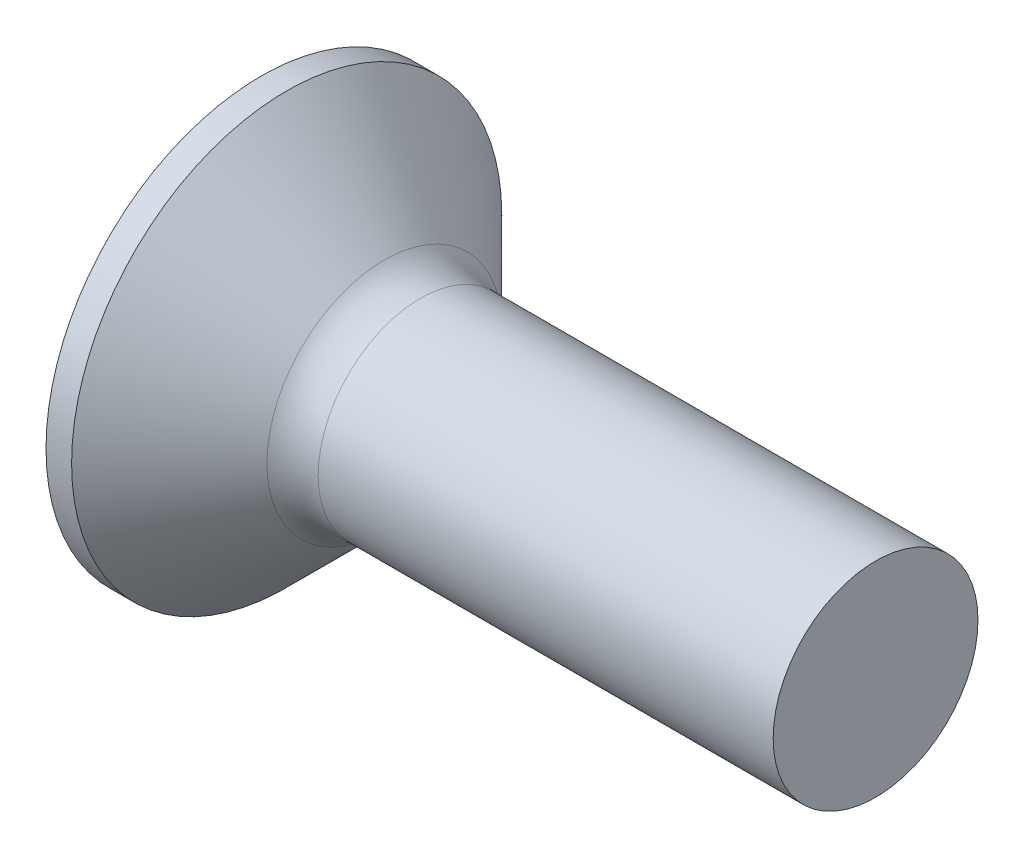
from build123d import *

# Parameters (mm, degrees)
FILLET1_R    = 1
RECPAT_COUNT = 2
RECPAT_ANGLE = 90


with BuildPart() as part:
    # BodySke → Base-Revolve (revolve)
    with BuildSketch(Plane.XY, mode=Mode.PRIVATE) as base_revolve_sk:
        Polygon((0, 0), (0, 4.2), (0.5, 4.2), (2.7, 2), (12, 2), (12, 0), align=None)
    revolve(base_revolve_sk.sketch.rotate(Axis((-6.35, 0, 0), (1, 0, 0)), 90), axis=Axis((-6.35, 0, 0), (1, 0, 0)))

    # Fillet1
    fillet1_edges = [part.edges().sort_by_distance(p)[0] for p in [
        (2.7, 0, -2),
    ]]
    fillet(fillet1_edges, radius=FILLET1_R)

    # Sketch3 → Recess section 0
    with BuildSketch(Plane.ZY):
        with BuildLine():
            Line((-0.515, 2.2), (0.515, 2.2))
            Line((0.515, 2.2), (0.515, -2.2))
            Line((0.515, -2.2), (-0.515, -2.2))
            Line((-0.515, -2.2), (-0.515, 2.2))
        make_face()
    # Sketch4 → Recess section 1
    with BuildSketch(Plane.ZY.offset(-2.51)):
        with BuildLine():
            Line((-0.515, 0.948560373), (0.515, 0.948560373))
            Line((0.515, 0.948560373), (0.515, -0.948560373))
            Line((0.515, -0.948560373), (-0.515, -0.948560373))
            Line((-0.515, -0.948560373), (-0.515, 0.948560373))
        make_face()
    recess = loft(mode=Mode.SUBTRACT)

    # RecPat: Recess ×2 about axis
    recpat_axis = Axis((0, 0, 0), (1, 0, 0))
    for i in range(1, RECPAT_COUNT):
        add(recess.rotate(recpat_axis, i * RECPAT_ANGLE / (RECPAT_COUNT - 1)), mode=Mode.SUBTRACT)

    # RecCorSke → RecessCore (revolve, cut)
    with BuildSketch(Plane.XY, mode=Mode.PRIVATE) as recesscore_sk:
        Polygon((0, 0), (0, 1.026516298), (2.51, 0.851), (2.786506661, 0), align=None)
    revolve(recesscore_sk.sketch.rotate(Axis((-3.175, 0, 0), (1, 0, 0)), 90), axis=Axis((-3.175, 0, 0), (1, 0, 0)), mode=Mode.SUBTRACT)


solid = part.part
